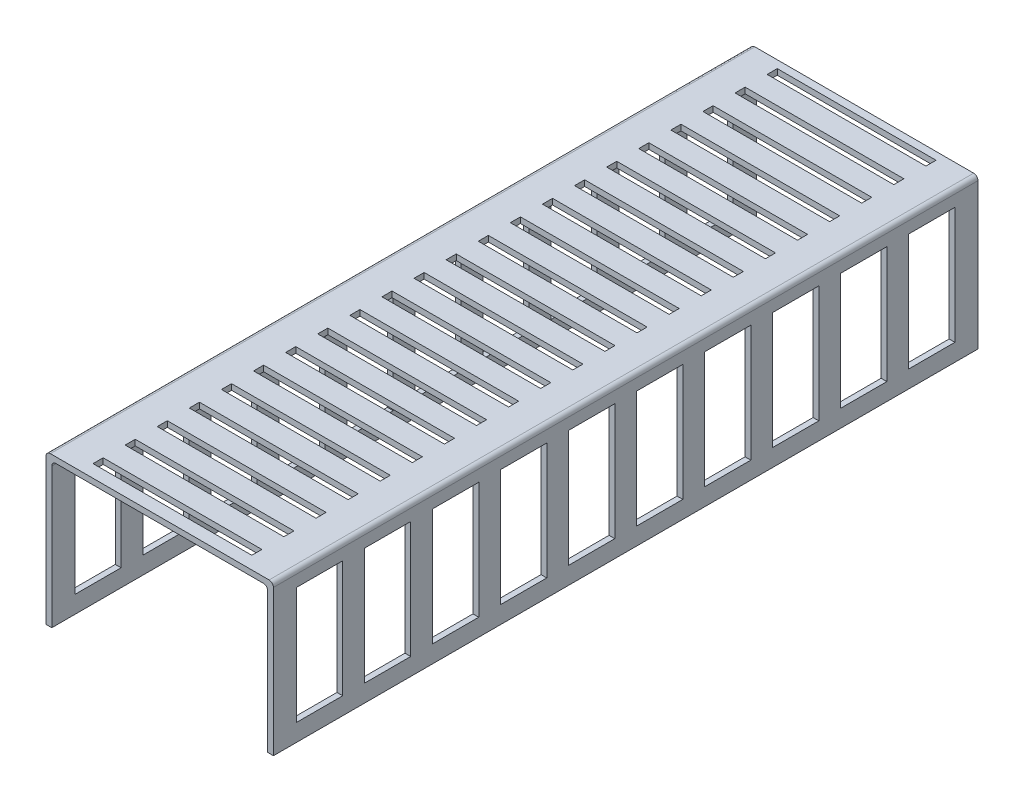
from build123d import *

# Parameters (mm, degrees)
SKETCH2_W           = 78.8
SKETCH2_H           = 244.1
SKETCH2_W_2         = 55
SKETCH2_H_2         = 3.5
BOSS_EXTRUDE1_DEPTH = 2
SKETCH3_W           = 2
SKETCH3_H           = 244.1
BOSS_EXTRUDE2_DEPTH = 50
FILLET1_R           = 1.5
SKETCH4_W           = 16
SKETCH4_H           = 40.5
CUT_EXTRUDE1_DEPTH  = 27507.713596192


with BuildPart() as part:
    # Sketch2 → Boss-Extrude1 (new body)
    with BuildSketch(Plane(origin=(0, 27504.249263039, 0), x_dir=(1, 0, 0), z_dir=(0, 1, 0))):
        with Locations((-7.2, 17)):
            Rectangle(SKETCH2_W, SKETCH2_H)
        with Locations((-7.2, 123.528571429)):
            Rectangle(SKETCH2_W_2, SKETCH2_H_2, mode=Mode.SUBTRACT)
        with Locations((-7.2, 134.65)):
            Rectangle(SKETCH2_W_2, SKETCH2_H_2, mode=Mode.SUBTRACT)
        with Locations((-7.2, 112.407142857)):
            Rectangle(SKETCH2_W_2, SKETCH2_H_2, mode=Mode.SUBTRACT)
        with Locations((-7.2, 101.285714286)):
            Rectangle(SKETCH2_W_2, SKETCH2_H_2, mode=Mode.SUBTRACT)
        with Locations((-7.2, 90.164285714)):
            Rectangle(SKETCH2_W_2, SKETCH2_H_2, mode=Mode.SUBTRACT)
        with Locations((-7.2, 79.042857143)):
            Rectangle(SKETCH2_W_2, SKETCH2_H_2, mode=Mode.SUBTRACT)
        with Locations((-7.2, 67.921428571)):
            Rectangle(SKETCH2_W_2, SKETCH2_H_2, mode=Mode.SUBTRACT)
        with Locations((-7.2, 56.8)):
            Rectangle(SKETCH2_W_2, SKETCH2_H_2, mode=Mode.SUBTRACT)
        with Locations((-7.2, 45.678571429)):
            Rectangle(SKETCH2_W_2, SKETCH2_H_2, mode=Mode.SUBTRACT)
        with Locations((-7.2, 34.557142857)):
            Rectangle(SKETCH2_W_2, SKETCH2_H_2, mode=Mode.SUBTRACT)
        with Locations((-7.2, 23.435714286)):
            Rectangle(SKETCH2_W_2, SKETCH2_H_2, mode=Mode.SUBTRACT)
        with Locations((-7.2, 12.314285714)):
            Rectangle(SKETCH2_W_2, SKETCH2_H_2, mode=Mode.SUBTRACT)
        with Locations((-7.2, 1.192857143)):
            Rectangle(SKETCH2_W_2, SKETCH2_H_2, mode=Mode.SUBTRACT)
        with Locations((-7.2, -9.928571429)):
            Rectangle(SKETCH2_W_2, SKETCH2_H_2, mode=Mode.SUBTRACT)
        with Locations((-7.2, -21.05)):
            Rectangle(SKETCH2_W_2, SKETCH2_H_2, mode=Mode.SUBTRACT)
        with Locations((-7.2, -32.171428571)):
            Rectangle(SKETCH2_W_2, SKETCH2_H_2, mode=Mode.SUBTRACT)
        with Locations((-7.2, -43.292857143)):
            Rectangle(SKETCH2_W_2, SKETCH2_H_2, mode=Mode.SUBTRACT)
        with Locations((-7.2, -54.414285714)):
            Rectangle(SKETCH2_W_2, SKETCH2_H_2, mode=Mode.SUBTRACT)
        with Locations((-7.2, -65.535714286)):
            Rectangle(SKETCH2_W_2, SKETCH2_H_2, mode=Mode.SUBTRACT)
        with Locations((-7.2, -76.657142857)):
            Rectangle(SKETCH2_W_2, SKETCH2_H_2, mode=Mode.SUBTRACT)
        with Locations((-7.2, -87.778571429)):
            Rectangle(SKETCH2_W_2, SKETCH2_H_2, mode=Mode.SUBTRACT)
        with Locations((-7.2, -98.9)):
            Rectangle(SKETCH2_W_2, SKETCH2_H_2, mode=Mode.SUBTRACT)
    extrude(amount=BOSS_EXTRUDE1_DEPTH)

    # Sketch3 → Boss-Extrude2 (add)
    with BuildSketch(Plane.XZ.offset(-27504.249263039)):
        with Locations((-45.6, -17)):
            Rectangle(SKETCH3_W, SKETCH3_H)
        with Locations((31.2, -17)):
            Rectangle(SKETCH3_W, SKETCH3_H)
    extrude(amount=BOSS_EXTRUDE2_DEPTH)

    # Fillet1
    fillet1_edges = [part.edges().sort_by_distance(p)[0] for p in [
        (32.2, 27506.249263039, -17),
        (-44.6, 27504.249263039, -17),
        (30.2, 27504.249263039, -17),
        (-46.6, 27506.249263039, -17),
    ]]
    fillet(fillet1_edges, radius=FILLET1_R)

    # Sketch4 → Cut-Extrude1 (cut, through all)
    with BuildSketch(Plane(origin=(32.2, 0, 0), x_dir=(0, 0, -1), z_dir=(1, 0, 0))):
        with Locations((-89.05, 27480.499263039)):
            Rectangle(SKETCH4_W, SKETCH4_H)
        with Locations((-65.483333333, 27480.499263039)):
            Rectangle(SKETCH4_W, SKETCH4_H)
        with Locations((-41.916666667, 27480.499263039)):
            Rectangle(SKETCH4_W, SKETCH4_H)
        with Locations((-18.35, 27480.499263039)):
            Rectangle(SKETCH4_W, SKETCH4_H)
        with Locations((5.216666667, 27480.499263039)):
            Rectangle(SKETCH4_W, SKETCH4_H)
        with Locations((28.783333333, 27480.499263039)):
            Rectangle(SKETCH4_W, SKETCH4_H)
        with Locations((52.35, 27480.499263039)):
            Rectangle(SKETCH4_W, SKETCH4_H)
        with Locations((75.916666667, 27480.499263039)):
            Rectangle(SKETCH4_W, SKETCH4_H)
        with Locations((99.483333333, 27480.499263039)):
            Rectangle(SKETCH4_W, SKETCH4_H)
        with Locations((123.05, 27480.499263039)):
            Rectangle(SKETCH4_W, SKETCH4_H)
    extrude(amount=-CUT_EXTRUDE1_DEPTH, mode=Mode.SUBTRACT)


solid = part.part
